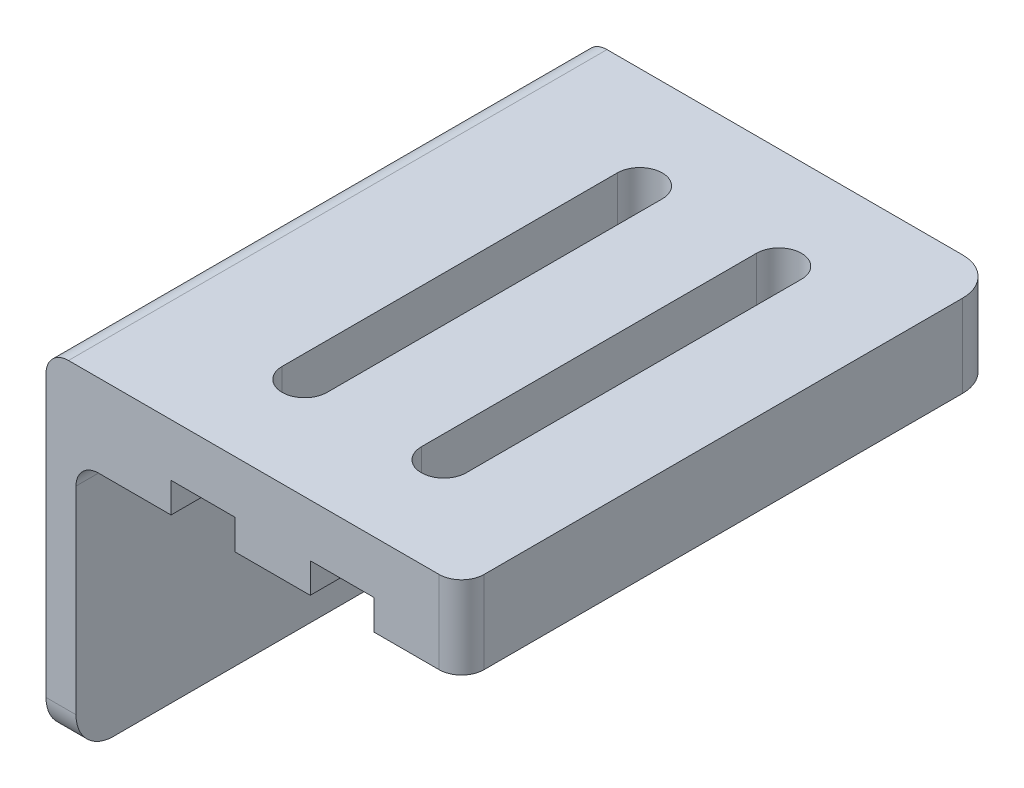
from build123d import *

# Parameters (mm, degrees)
BOSS_EXTRUDE1_START             = 0.2
SKETCH2_W                       = 41.966567091
SKETCH2_H                       = 11
SKETCH2_H_2                     = 34.4
SKETCH2_R                       = 4
SKETCH2_H_3                     = 4
BOSS_EXTRUDE1_DEPTH             = 4
BOSS_EXTRUDE2_REACH             = 197.713
SKETCH2_3_W                     = 41.966567091
SKETCH2_3_H                     = 11
SKETCH2_3_H_2                   = 4
BOSS_EXTRUDE2_DIRECTION_2_DEPTH = 60.2
FILLET1_R                       = 3
SKETCH3_W                       = 9
SKETCH3_H                       = 11.2
CUT_EXTRUDE1_DEPTH              = 24.029037182
SKETCH4_W                       = 71.659193782
SKETCH4_H                       = 19.690367256
SKETCH4_R                       = 3.18615952
BOSS_EXTRUDE3_DEPTH             = 4
FILLET2_R                       = 3
BOSS_EXTRUDE4_START             = -11
SKETCH5_W                       = 55.4
SKETCH5_H                       = 29.820392461
BOSS_EXTRUDE4_DEPTH             = 11
FILLET3_R                       = 3
CUT_EXTRUDE2_DEPTH              = 258.572392856
CUT_EXTRUDE2_DEPTH_BACK         = 258.572392856
SKETCH7_W                       = 8.5
SKETCH7_H                       = 4
FILLET6_R                       = 2
CUT_EXTRUDE3_REACH              = 172.81
CUT_EXTRUDE4_DEPTH              = 174.523300181
CUT_EXTRUDE4_DEPTH_BACK         = 174.523300181
FILLET7_R                       = 5
BOSS_EXTRUDE5_START             = -4
SKETCH10_W                      = 29.820392461
SKETCH10_H                      = 34.4
BOSS_EXTRUDE5_DEPTH             = 4
BOSS_EXTRUDE6_START             = 29.82039246
BOSS_EXTRUDE6_DEPTH             = 29.82039246
CUT_EXTRUDE5_DEPTH              = 210.306605099
CUT_EXTRUDE5_DEPTH_BACK         = 210.306605099
CUT_EXTRUDE6_DEPTH              = 210.306605099
CUT_EXTRUDE6_DEPTH_BACK         = 210.306605099
SKETCH15_W                      = 78.727492145
SKETCH15_H                      = 13.85710387
CUT_EXTRUDE8_REACH              = 163.596
SKETCH16_W                      = 13.433327452
SKETCH16_H                      = 52.832089958
FILLET8_R                       = 5


with BuildPart() as part:
    # Sketch2 → Boss-Extrude1 (new body)
    # profile 1 of 3: a face of its own
    with BuildSketch(Plane.ZY.offset(-93.4).offset(BOSS_EXTRUDE1_START)):
        with Locations((5.257762951, -150)):
            Rectangle(SKETCH2_W, SKETCH2_H)
    # profile 2 of 3: a face of its own
    with BuildSketch(Plane.ZY.offset(-93.4).offset(BOSS_EXTRUDE1_START)):
        with Locations((5.257762951, -172.7)):
            Rectangle(SKETCH2_W, SKETCH2_H_2)
        with Locations((5.257762951, -173.849326746)):
            Circle(SKETCH2_R, mode=Mode.SUBTRACT)
    # profile 3 of 3: a face of its own
    with BuildSketch(Plane.ZY.offset(-93.4).offset(BOSS_EXTRUDE1_START)):
        with Locations((5.257762951, -191.9)):
            Rectangle(SKETCH2_W, SKETCH2_H_3)
    extrude(amount=BOSS_EXTRUDE1_DEPTH)

    # Sketch2<3> → Boss-Extrude2 (add, up to next)
    with BuildSketch(Plane.ZY.offset(-93.4), mode=Mode.PRIVATE) as boss_extrude2_sk1:
        with Locations((5.257762951, -150)):
            Rectangle(SKETCH2_3_W, SKETCH2_3_H)
    boss_extrude2_tool1 = extrude(boss_extrude2_sk1.sketch, amount=BOSS_EXTRUDE2_REACH, mode=Mode.PRIVATE) - part.part
    # Sketch2<3> → Boss-Extrude2 (add, up to next)
    with BuildSketch(Plane.ZY.offset(-93.4), mode=Mode.PRIVATE) as boss_extrude2_sk2:
        with Locations((5.257762951, -191.9)):
            Rectangle(SKETCH2_3_W, SKETCH2_3_H_2)
    boss_extrude2_tool2 = extrude(boss_extrude2_sk2.sketch, amount=BOSS_EXTRUDE2_REACH, mode=Mode.PRIVATE) - part.part
    add(boss_extrude2_tool1.solids().sort_by_distance((93.4, -150, 5.257763))[0])
    add(boss_extrude2_tool2.solids().sort_by_distance((93.4, -191.9, 5.257763))[0])

    # Sketch2<3> → Boss-Extrude2 direction 2 (add)
    with BuildSketch(Plane.ZY.offset(-93.4)):
        with Locations((5.257762951, -150)):
            Rectangle(SKETCH2_3_W, SKETCH2_3_H)
        with Locations((5.257762951, -191.9)):
            Rectangle(SKETCH2_3_W, SKETCH2_3_H_2)
    extrude(amount=-BOSS_EXTRUDE2_DIRECTION_2_DEPTH)

    # Fillet1
    fillet1_edges = [part.edges().sort_by_distance(p)[0] for p in [
        (89.2, -193.9, 5.257762951),
        (93.2, -155.5, 5.257762951),
        (153.6, -191.9, 26.241046496),
        (93.2, -189.9, 5.257762951),
        (153.6, -191.9, -15.725520595),
    ]]
    fillet(fillet1_edges, radius=FILLET1_R)

    # Sketch3 → Cut-Extrude1 (cut)
    with BuildSketch(Plane.XY.offset(26.241046496)):
        with Locations((149.1, -150.1)):
            Rectangle(SKETCH3_W, SKETCH3_H)
    extrude(amount=-CUT_EXTRUDE1_DEPTH, mode=Mode.SUBTRACT)

    # Sketch4 → Boss-Extrude3 (add)
    with BuildSketch(Plane(origin=(153.6, 0, 0), x_dir=(0, 0, -1), z_dir=(1, 0, 0))):
        with Locations((-20.104076296, -145.654816372)):
            Rectangle(SKETCH4_W, SKETCH4_H)
        with Locations((-39.297424086, -145.700936153)):
            Circle(SKETCH4_R, mode=Mode.SUBTRACT)
        with Locations((-9.68615952, -145.700936153)):
            Circle(SKETCH4_R, mode=Mode.SUBTRACT)
    extrude(amount=-BOSS_EXTRUDE3_DEPTH)

    # Fillet2
    fillet2_edges = [part.edges().sort_by_distance(p)[0] for p in [
        (149.6, -144.5, -6.75675564),
        (151.6, -135.809632744, -15.725520595),
        (151.6, -135.809632744, 55.933673187),
    ]]
    fillet(fillet2_edges, radius=FILLET2_R)

    # Sketch5 → Boss-Extrude4 (add)
    with BuildSketch(Plane(origin=(0, -144.5, 0), x_dir=(1, 0, 0), z_dir=(0, 1, 0)).offset(BOSS_EXTRUDE4_START)):
        with Locations((116.9, -41.151242727)):
            Rectangle(SKETCH5_W, SKETCH5_H)
    extrude(amount=BOSS_EXTRUDE4_DEPTH)

    # Fillet3
    fillet3_edges = [part.edges().sort_by_distance(p)[0] for p in [
        (144.6, -150, 56.061438957),
        (89.2, -144.5, 20.167959181),
    ]]
    fillet(fillet3_edges, radius=FILLET3_R)

    # Sketch7 → Cut-Extrude2 (cut, two sides: drawn at the far end of the back side and taken through both)
    with BuildSketch(Plane(origin=(0, 0, -15.725520595), x_dir=(-1, 0, 0), z_dir=(0, 0, -1)).offset(-CUT_EXTRUDE2_DEPTH_BACK)):
        with Locations((-128.677790471, -153.5)):
            Rectangle(SKETCH7_W, SKETCH7_H)
        with Locations((-110.122209529, -153.5)):
            Rectangle(SKETCH7_W, SKETCH7_H)
    extrude(amount=CUT_EXTRUDE2_DEPTH + CUT_EXTRUDE2_DEPTH_BACK, mode=Mode.SUBTRACT)

    # Fillet6
    fillet6_edges = [part.edges().sort_by_distance(p)[0] for p in [
        (144.6, -150, 2.212009314),
    ]]
    fillet(fillet6_edges, radius=FILLET6_R)

    # Sketch8 → Cut-Extrude3 (cut, up to next)
    with BuildSketch(Plane(origin=(0, -144.5, 0), x_dir=(1, 0, 0), z_dir=(0, 1, 0)), mode=Mode.PRIVATE) as cut_extrude3_sk1:
        with BuildLine():
            Line((113.122209529, 2.172515143), (113.122209529, -42.508433505))
            ThreePointArc((113.122209529, -42.508433505), (110.122209529, -45.508433505), (107.122209529, -42.508433505))
            Line((107.122209529, -42.508433505), (107.122209529, 2.172515143))
            ThreePointArc((107.122209529, 2.172515143), (110.122209529, 5.172515143), (113.122209529, 2.172515143))
        make_face()
    cut_extrude3_tool1 = extrude(cut_extrude3_sk1.sketch, amount=-CUT_EXTRUDE3_REACH, mode=Mode.PRIVATE) & part.part
    # Sketch8 → Cut-Extrude3 (cut, up to next)
    with BuildSketch(Plane(origin=(0, -144.5, 0), x_dir=(1, 0, 0), z_dir=(0, 1, 0)), mode=Mode.PRIVATE) as cut_extrude3_sk2:
        with BuildLine():
            Line((125.677790471, 2.172515143), (125.677790471, -42.508433505))
            ThreePointArc((125.677790471, -42.508433505), (128.677790471, -45.508433505), (131.677790471, -42.508433505))
            Line((131.677790471, -42.508433505), (131.677790471, 2.172515143))
            ThreePointArc((131.677790471, 2.172515143), (128.677790471, 5.172515143), (125.677790471, 2.172515143))
        make_face()
    cut_extrude3_tool2 = extrude(cut_extrude3_sk2.sketch, amount=-CUT_EXTRUDE3_REACH, mode=Mode.PRIVATE) & part.part
    add(cut_extrude3_tool1.solids().sort_by_distance((110.12221, -144.5, 20.167959))[0], mode=Mode.SUBTRACT)
    add(cut_extrude3_tool2.solids().sort_by_distance((128.67779, -144.5, 20.167959))[0], mode=Mode.SUBTRACT)

    # Sketch9 → Cut-Extrude4 (cut, two sides: drawn at the far end of the back side and taken through both)
    with BuildSketch(Plane(origin=(0, -135.809632744, 0), x_dir=(1, 0, 0), z_dir=(0, 1, 0)).offset(-CUT_EXTRUDE4_DEPTH_BACK)):
        Polygon((144.6, 47.11572478), (144.6, -77.58184164), (185.54461202, -56.674351197), (190.182137353, 46.607841752), align=None)
    extrude(amount=CUT_EXTRUDE4_DEPTH + CUT_EXTRUDE4_DEPTH_BACK, mode=Mode.SUBTRACT)

    # Fillet7
    fillet7_edges = [part.edges().sort_by_distance(p)[0] for p in [
        (144.6, -150, -15.725520595),
    ]]
    fillet(fillet7_edges, radius=FILLET7_R)

    # Sketch10 → Boss-Extrude5 (add)
    with BuildSketch(Plane.ZY.offset(-89.2).offset(BOSS_EXTRUDE5_START)):
        with Locations((41.151242727, -172.7)):
            Rectangle(SKETCH10_W, SKETCH10_H)
    extrude(amount=BOSS_EXTRUDE5_DEPTH)

    # Sketch11 → Boss-Extrude6 (add)
    with BuildSketch(Plane.XY.offset(26.241046496).offset(BOSS_EXTRUDE6_START)):
        with BuildLine():
            Line((93.2, -155.5), (93.2, -158.5))
            ThreePointArc((93.2, -158.5), (94.078679656, -156.378679656), (96.2, -155.5))
            Line((96.2, -155.5), (93.2, -155.5))
        make_face()
    extrude(amount=-BOSS_EXTRUDE6_DEPTH)

    # Sketch14 → Cut-Extrude5 (cut, two sides: drawn at the far end of the back side and taken through both)
    with BuildSketch(Plane.ZY.offset(-89.2).offset(-CUT_EXTRUDE5_DEPTH_BACK)):
        with BuildLine():
            Line((9.257762951, -168.408548592), (9.257762951, -179.290104899))
            ThreePointArc((9.257762951, -179.290104899), (5.257762951, -183.290104899), (1.257762951, -179.290104899))
            Line((1.257762951, -179.290104899), (1.257762951, -168.408548592))
            ThreePointArc((1.257762951, -168.408548592), (5.257762951, -164.408548592), (9.257762951, -168.408548592))
        make_face()
    extrude(amount=CUT_EXTRUDE5_DEPTH + CUT_EXTRUDE5_DEPTH_BACK, mode=Mode.SUBTRACT)

    # Sketch15 → Cut-Extrude6 (cut, two sides: drawn at the far end of the back side and taken through both)
    with BuildSketch(Plane.ZY.offset(-89.2).offset(-CUT_EXTRUDE6_DEPTH_BACK)):
        with Locations((22.135388596, -196.828551935)):
            Rectangle(SKETCH15_W, SKETCH15_H)
    extrude(amount=CUT_EXTRUDE6_DEPTH + CUT_EXTRUDE6_DEPTH_BACK, mode=Mode.SUBTRACT)

    # Sketch16 → Cut-Extrude8 (cut, up to next)
    with BuildSketch(Plane.XZ.offset(189.9), mode=Mode.PRIVATE) as cut_extrude8_sk1:
        with Locations((99.916663726, 10.690524384)):
            Rectangle(SKETCH16_W, SKETCH16_H)
    cut_extrude8_tool1 = extrude(cut_extrude8_sk1.sketch, amount=-CUT_EXTRUDE8_REACH, mode=Mode.PRIVATE) & part.part
    add(cut_extrude8_tool1.solids().sort_by_distance((99.916664, -189.9, 10.690524))[0], mode=Mode.SUBTRACT)

    # Fillet8
    fillet8_edges = [part.edges().sort_by_distance(p)[0] for p in [
        (91.2, -189.9, 56.061438957),
        (91.2, -189.9, -15.725520595),
    ]]
    fillet(fillet8_edges, radius=FILLET8_R)


solid = part.part
